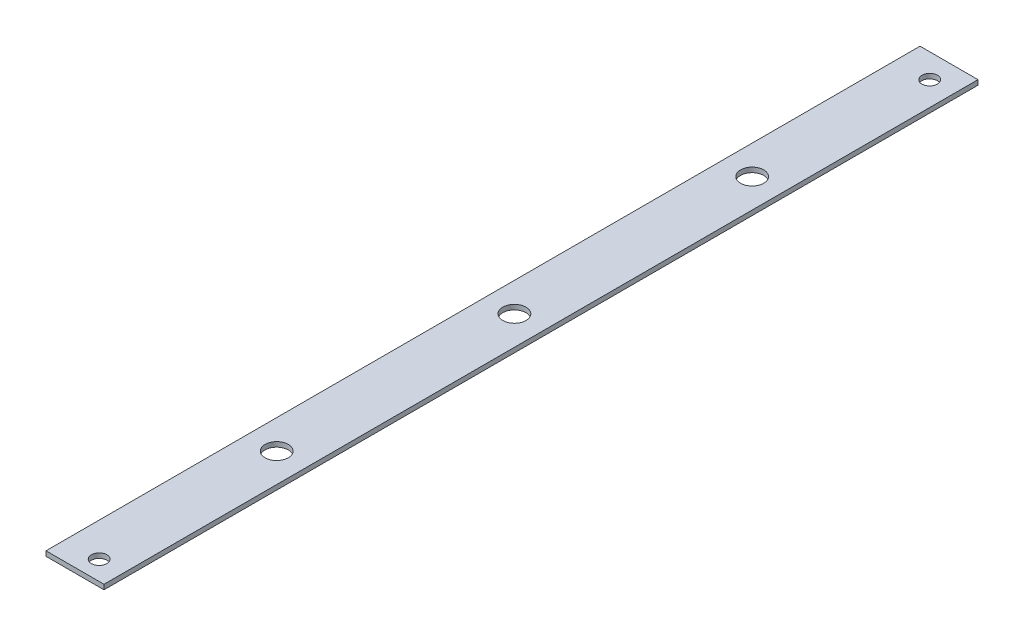
from build123d import *

# Parameters (mm, degrees)
BOSS_EXTRUDE1_DEPTH = 226.1
SKETCH2_R           = 4
SKETCH2_R_2         = 6
CUT_EXTRUDE1_DEPTH  = 229.095287106


with BuildPart() as part:
    # Sketch1 → Boss-Extrude1 (new, symmetric)
    with BuildSketch(Plane.XY):
        Polygon((0, 0), (0, 2.5), (2.5, 2.5), (30, 2.5), (30, 0), align=None)
    extrude(amount=BOSS_EXTRUDE1_DEPTH, both=True)

    # Sketch2 → Cut-Extrude1 (cut, through all)
    with BuildSketch(Plane(origin=(0, 2.5, 0), x_dir=(1, 0, 0), z_dir=(0, 1, 0))):
        with Locations(Location((17.5, 213.6, 0), (0, 0, 180))):
            Circle(SKETCH2_R)
        with Locations((17.5, -216.1)):
            Circle(SKETCH2_R)
        with Locations(Location((15, -121.75, 0), (0, 0, 180))):
            Circle(SKETCH2_R_2)
        with Locations(Location((15, 124.25, 0), (0, 0, 180))):
            Circle(SKETCH2_R_2)
        with Locations(Location((15, 1.25, 0), (0, 0, 180))):
            Circle(SKETCH2_R_2)
    extrude(amount=-CUT_EXTRUDE1_DEPTH, mode=Mode.SUBTRACT)


solid = part.part
